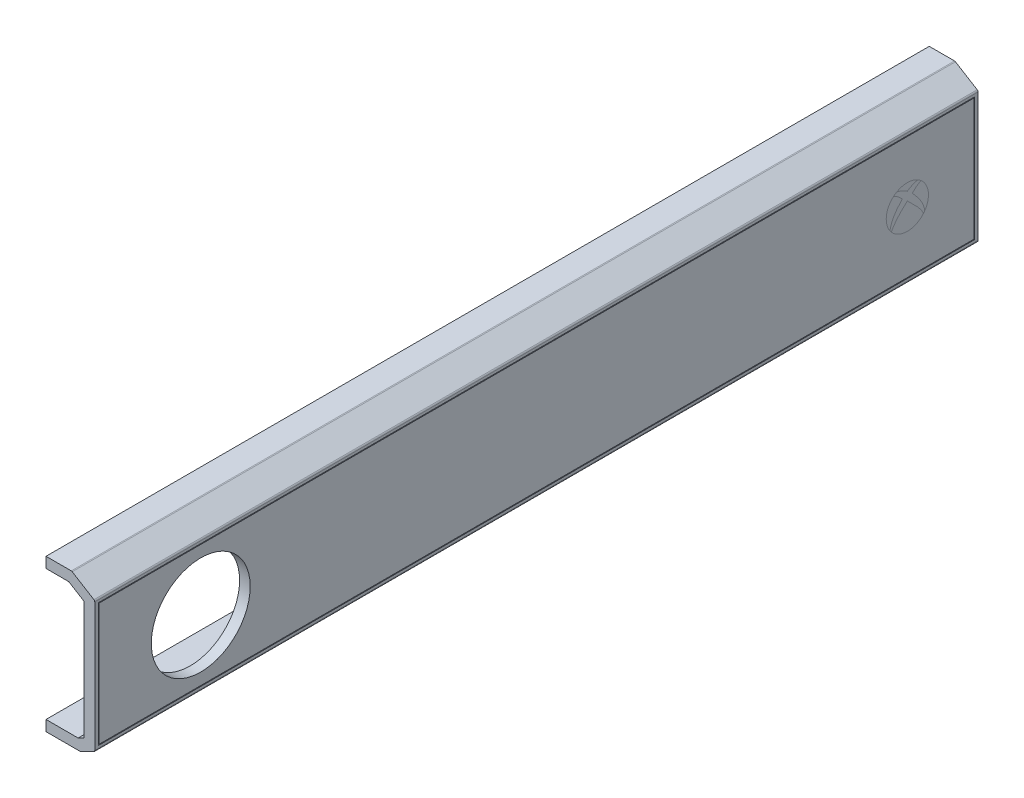
from build123d import *

# Parameters (mm, degrees)
BOSS_EXTRUDE1_DEPTH = 250
CUT_EXTRUDE1_REACH  = 256.046
SKETCH2_W           = 10.8
SKETCH2_H           = 114
SKETCH3_W           = 248
SKETCH3_H           = 35
SKETCH3_W_2         = 247.6
SKETCH3_H_2         = 34.6
CUT_EXTRUDE2_DEPTH  = 0.2
FILLET1_R           = 0.5
SKETCH4_R           = 14
CUT_EXTRUDE3_DEPTH  = 255.046137542


with BuildPart() as part:
    # Sketch1 → Boss-Extrude1 (new body)
    with BuildSketch(Plane.XY):
        Polygon((0, 3), (9.091796068, 3), (10.8, 3.854101966), (10.8, 37.323614418), (6.450873429, 40), (0, 40), (0, 43), (7.3, 43), (13.8, 39), (13.8, 2), (9.8, 0), (0, 0), align=None)
    extrude(amount=BOSS_EXTRUDE1_DEPTH)

    # Sketch2 → Cut-Extrude1 (cut, up to next)
    with BuildSketch(Plane.XZ, mode=Mode.PRIVATE) as cut_extrude1_sk1:
        with Locations((5.4, 125)):
            Rectangle(SKETCH2_W, SKETCH2_H)
    cut_extrude1_tool1 = extrude(cut_extrude1_sk1.sketch, amount=-CUT_EXTRUDE1_REACH, mode=Mode.PRIVATE) & part.part
    add(cut_extrude1_tool1.solids().sort_by_distance((5.4, 0, 125))[0], mode=Mode.SUBTRACT)

    # Sketch3 → Cut-Extrude2 (cut)
    with BuildSketch(Plane(origin=(13.8, 0, 0), x_dir=(0, 0, -1), z_dir=(1, 0, 0))):
        with Locations((-125, 20.5)):
            Rectangle(SKETCH3_W, SKETCH3_H)
        with Locations((-125, 20.5)):
            Rectangle(SKETCH3_W_2, SKETCH3_H_2, mode=Mode.SUBTRACT)
    extrude(amount=-CUT_EXTRUDE2_DEPTH, mode=Mode.SUBTRACT)

    # Fillet1
    fillet1_edges = [part.edges().sort_by_distance(p)[0] for p in [
        (13.8, 39, 125),
        (13.8, 2, 125),
        (9.8, 0, 216),
        (7.3, 43, 125),
        (9.8, 0, 34),
    ]]
    fillet(fillet1_edges, radius=FILLET1_R)

    # Sketch4 → Cut-Extrude3 (cut, through all)
    with BuildSketch(Plane(origin=(13.8, 0, 0), x_dir=(0, 0, -1), z_dir=(1, 0, 0))):
        with Locations((-220, 20.514809699)):
            Circle(SKETCH4_R)
    extrude(amount=-CUT_EXTRUDE3_DEPTH, mode=Mode.SUBTRACT)


solid = part.part
